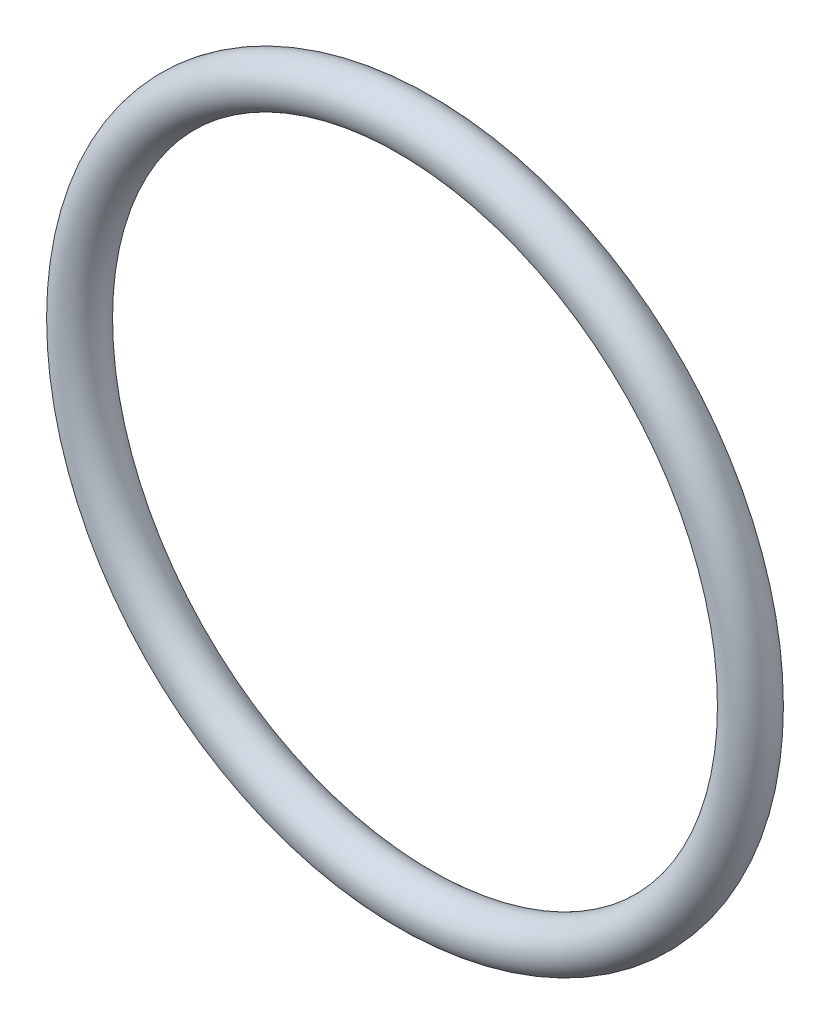
from build123d import *

# Parameters (mm, degrees)
SKETCH1_R = 1.7653


with BuildPart() as part:
    # Sketch1 → Revolve1 (revolve)
    with BuildSketch(Plane(origin=(0, 0, 0), x_dir=(0, -1, 0), z_dir=(1, 0, 0)), mode=Mode.PRIVATE) as revolve1_sk:
        with Locations((25.3746, 0)):
            Circle(SKETCH1_R)
    revolve(revolve1_sk.sketch.rotate(Axis((0, 0, 1.7653), (0, 0, -1)), 270), axis=Axis((0, 0, 1.7653), (0, 0, -1)))


solid = part.part
